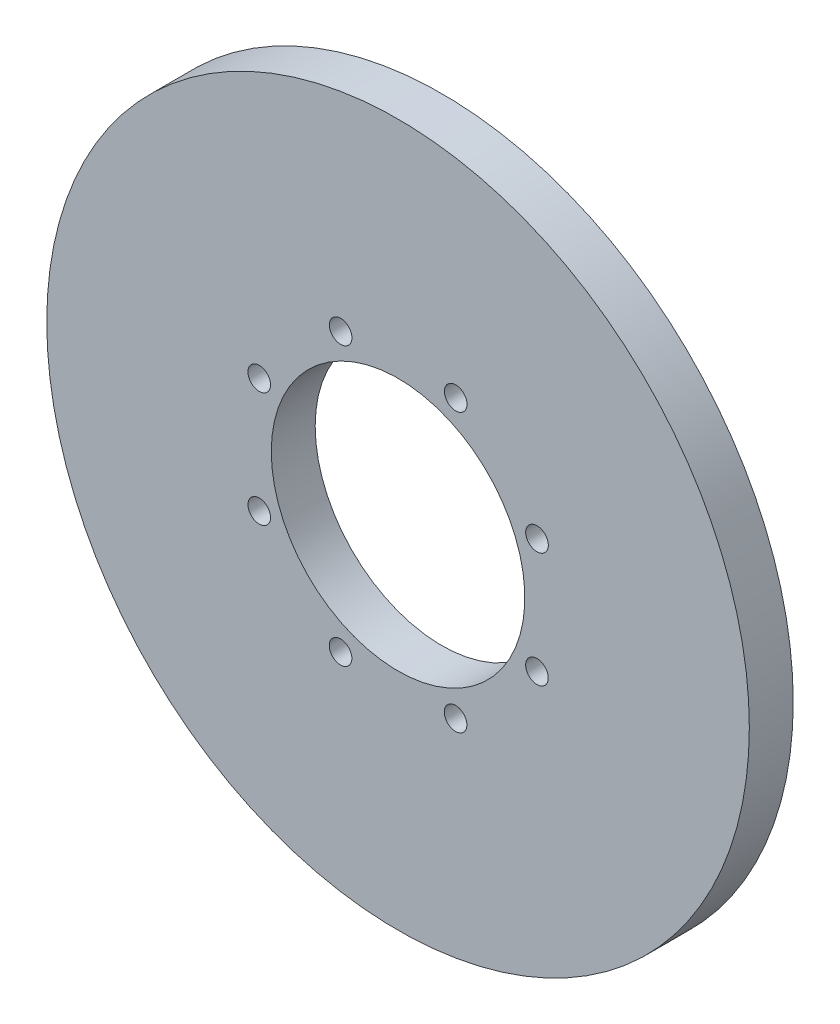
from build123d import *

# Parameters (mm, degrees)
SKETCH1_R               = 152.4
BOSS_EXTRUDE1_DEPTH     = 19.05
SKETCH5_R               = 55
CUT_EXTRUDE1_DEPTH      = 217.366407975
F_3_8_CLEARANCE_HOLE1_D = 9.8044


with BuildPart() as part:
    # Sketch1 → Boss-Extrude1 (new body)
    with BuildSketch(Plane.XY):
        with Locations(Location((0, 0, 0), (0, 0, 180))):
            Circle(SKETCH1_R)
    extrude(amount=BOSS_EXTRUDE1_DEPTH)

    # Sketch5 → Cut-Extrude1 (cut, through all)
    with BuildSketch(Plane(origin=(0, 0, 0), x_dir=(-1, 0, 0), z_dir=(0, 0, -1))):
        Circle(SKETCH5_R)
    extrude(amount=-CUT_EXTRUDE1_DEPTH, mode=Mode.SUBTRACT)

    # 3/8 Clearance Hole1 (through all)
    with Locations(Plane.XY.offset(19.05)):
        with Locations((60.285109168, 24.861699689), (60.262270723, -25.040419345), (-24.942124319, -60.287558469), (-60.212101884, -24.985282473), (24.959994735, -60.310396903), (-60.212101884, 24.861699689), (-24.88698742, 60.186814133), (25.015131626, 60.163975676)):
            Hole(F_3_8_CLEARANCE_HOLE1_D / 2)


solid = part.part
